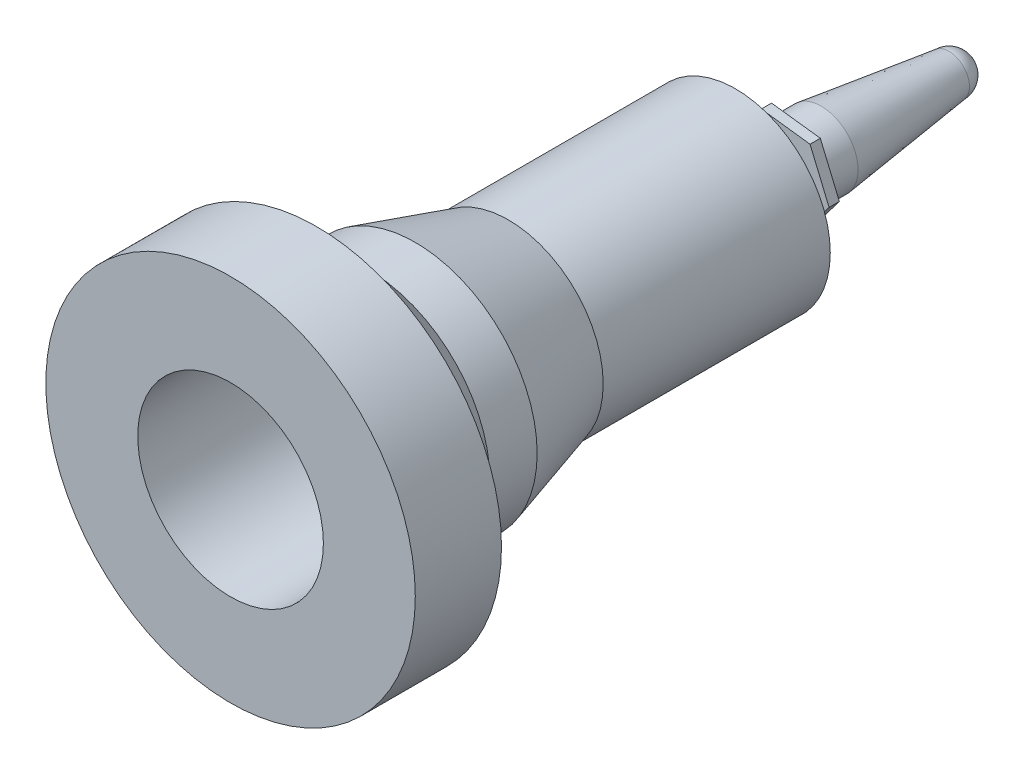
from build123d import *

# Parameters (mm, degrees)
BOSS_EXTRUDE1_DEPTH = 10
SKETCH5_R           = 180
SKETCH5_R_2         = 90.447985836
BOSS_EXTRUDE2_DEPTH = 84
CHAMFER1_SIZE       = 50


with BuildPart() as part:
    # Sketch2 → Revolve1 (revolve)
    with BuildSketch(Plane(origin=(0, 0, 0), x_dir=(0, 0, -1), z_dir=(1, 0, 0)), mode=Mode.PRIVATE) as revolve1_sk:
        with BuildLine():
            Line((0, 0), (700, 0))
            Line((700, 0), (720, 0))
            ThreePointArc((720, 0), (714.142135624, 14.142135624), (700, 20))
            Line((700, 20), (575.510554629, 35.889479609))
            Line((575.510554629, 35.889479609), (545.741946393, 35.889479609))
            Line((545.741946393, 35.889479609), (545.741946393, 24))
            Line((545.741946393, 24), (492, 24))
            Line((492, 24), (492, 92.350959719))
            Line((492, 92.350959719), (270.736708403, 92.350959719))
            Line((270.736708403, 92.350959719), (180, 118.736948211))
            Line((180, 118.736948211), (0, 118.736948211))
            Line((0, 118.736948211), (0, 0))
        make_face()
    revolve(revolve1_sk.sketch.rotate(Axis((0, 0, 0), (0, 0, -1)), 90), axis=Axis((0, 0, 0), (0, 0, -1)))

    # Sketch3 → Boss-Extrude1 (add)
    with BuildSketch(Plane.XY.offset(-545.741946393)):
        Polygon((47.46164508, -5.94638242), (28.880540777, 38.129799135), (-18.581104304, 44.076181555), (-47.46164508, 5.94638242), (-28.880540777, -38.129799135), (18.581104304, -44.076181555), align=None)
    extrude(amount=BOSS_EXTRUDE1_DEPTH)

    # Sketch4 → Cut-Revolve6 (revolve, cut)
    with BuildSketch(Plane(origin=(0, 0, 0), x_dir=(0, 0, -1), z_dir=(1, 0, 0)), mode=Mode.PRIVATE) as cut_revolve6_sk:
        Polygon((0, 0), (720, 0), (720, 4.24350933), (575.510554629, 16.375367187), (477.848045129, 16.375367187), (416.651810859, 69.245469072), (270.736708403, 69.245469072), (179.731042443, 90.447985836), (0, 90.447985836), align=None)
    revolve(cut_revolve6_sk.sketch.rotate(Axis((0, 0, 0), (0, 0, -1)), 90), axis=Axis((0, 0, 0), (0, 0, -1)), mode=Mode.SUBTRACT)

    # Sketch5 → Boss-Extrude2 (add)
    with BuildSketch(Plane.XY):
        Circle(SKETCH5_R)
        Circle(SKETCH5_R_2, mode=Mode.SUBTRACT)
    extrude(amount=-BOSS_EXTRUDE2_DEPTH)

    # Chamfer1
    chamfer1_edges = [part.edges().sort_by_distance(p)[0] for p in [
        (-118.736948211, 0, -84),
    ]]
    chamfer(chamfer1_edges, length=CHAMFER1_SIZE)


solid = part.part
